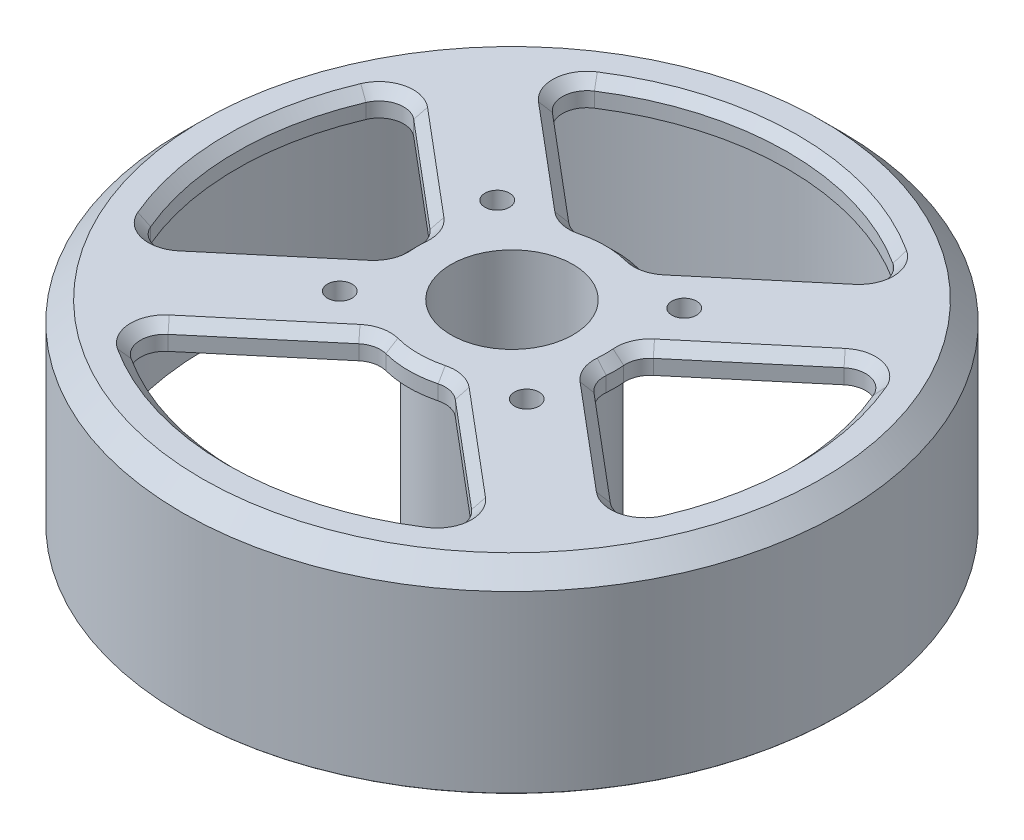
from build123d import *

# Parameters (mm, degrees)
HOLE_WIZARD_M3_1_D  = 2.5
CUT_EXTRUDE_1_DEPTH = 10
CHAMFER_1_SIZE      = 2
FILLET_1_R          = 2.5
CHAMFER_2_SIZE      = 1
CHAMFER_3_SIZE      = 0.05
CHAMFER_4_SIZE      = 0.05


with BuildPart() as part:
    # 草图6 → 旋转1 (revolve)
    with BuildSketch(Plane.XY, mode=Mode.PRIVATE) as revolve_1_sk:
        Polygon((33.5, 0), (33.5, 19.8), (6.2, 19.8), (6.2, -5.621788423), (4.95, -5.621788423), (4.95, -11.5), (6.2, -11.5), (6.2, -8.5), (9, -8.5), (9, -7.3), (8, -4), (8, 17.3), (31, 17.3), (31, 0), align=None)
    revolve(revolve_1_sk.sketch.rotate(Axis((0, 0, 0), (0, 1, 0)), 90), axis=Axis((0, 0, 0), (0, 1, 0)))

    # M3 螺纹孔1 (through all)
    with Locations(Plane(origin=(0, 19.8, 0), x_dir=(1, 0, 0), z_dir=(0, 1, 0))):
        with Locations((9.5, -8), (-9.5, -8), (-9.5, 8), (9.5, 8)):
            Hole(HOLE_WIZARD_M3_1_D / 2)

    # 草图11 → 切除-拉伸1 (cut)
    with BuildSketch(Plane(origin=(0, 19.8, 0), x_dir=(1, 0, 0), z_dir=(0, 1, 0))):
        with BuildLine():
            Line((17.852590074, 21.570466561), (3.841817237, 9.771921015))
            ThreePointArc((3.841817237, 9.771921015), (0, 10.5), (-3.841817237, 9.771921015))
            Line((-3.841817237, 9.771921015), (-17.852590074, 21.570466561))
            ThreePointArc((-17.852590074, 21.570466561), (0, 28), (17.852590074, 21.570466561))
        make_face()
        with BuildLine():
            Line((24.293947531, -13.92135458), (10.283174695, -2.122809033))
            ThreePointArc((10.283174695, -2.122809033), (10.5, 0), (10.283174695, 2.122809033))
            Line((10.283174695, 2.122809033), (24.293947531, 13.92135458))
            ThreePointArc((24.293947531, 13.92135458), (28, 0), (24.293947531, -13.92135458))
        make_face()
        with BuildLine():
            Line((17.852590074, -21.570466561), (3.841817237, -9.771921015))
            ThreePointArc((3.841817237, -9.771921015), (0, -10.5), (-3.841817237, -9.771921015))
            Line((-3.841817237, -9.771921015), (-17.852590074, -21.570466561))
            ThreePointArc((-17.852590074, -21.570466561), (0, -28), (17.852590074, -21.570466561))
        make_face()
        with BuildLine():
            Line((-10.283174695, 2.122809033), (-24.293947531, 13.92135458))
            ThreePointArc((-24.293947531, 13.92135458), (-28, 0), (-24.293947531, -13.92135458))
            Line((-24.293947531, -13.92135458), (-10.283174695, -2.122809033))
            ThreePointArc((-10.283174695, -2.122809033), (-10.5, 0), (-10.283174695, 2.122809033))
        make_face()
    extrude(amount=-CUT_EXTRUDE_1_DEPTH, mode=Mode.SUBTRACT)

    # 倒角1
    chamfer_1_edges = [part.edges().sort_by_distance(p)[0] for p in [
        (0, 19.8, 33.5),
    ]]
    chamfer(chamfer_1_edges, length=CHAMFER_1_SIZE)

    # 圆角1
    fillet_1_edges = [part.edges().sort_by_distance(p)[0] for p in [
        (17.852590074, 18.55, 21.570466561),
        (-17.852590074, 18.55, 21.570466561),
        (-3.841817237, 18.55, 9.771921015),
        (3.841817237, 18.55, 9.771921015),
        (24.293947531, 18.55, -13.92135458),
        (24.293947531, 18.55, 13.92135458),
        (10.283174695, 18.55, 2.122809033),
        (10.283174695, 18.55, -2.122809033),
        (-24.293947531, 18.55, 13.92135458),
        (-24.293947531, 18.55, -13.92135458),
        (-10.283174695, 18.55, -2.122809033),
        (-10.283174695, 18.55, 2.122809033),
        (-17.852590074, 18.55, -21.570466561),
        (17.852590074, 18.55, -21.570466561),
        (3.841817237, 18.55, -9.771921015),
        (-3.841817237, 18.55, -9.771921015),
    ]]
    fillet(fillet_1_edges, radius=FILLET_1_R)

    # 倒角2
    chamfer_2_edges = [part.edges().sort_by_distance(p)[0] for p in [
        (0, 19.8, 28),
        (-10.161632191, 19.8, 15.093870449),
        (0, 19.8, 10.5),
        (10.161632191, 19.8, 15.093870449),
        (28, 19.8, 0),
        (16.602989649, 19.8, 7.444758468),
        (10.5, 19.8, 0),
        (16.602989649, 19.8, -7.444758468),
        (0, 19.8, -28),
        (10.161632191, 19.8, -15.093870449),
        (-10.161632191, 19.8, -15.093870449),
        (0, 19.8, -10.5),
        (-16.602989649, 19.8, 7.444758468),
        (-28, 19.8, 0),
        (-10.5, 19.8, 0),
        (-16.602989649, 19.8, -7.444758468),
        (-16.306405676, 19.8, 21.595078628),
        (-3.841486524, 19.8, 10.13784984),
        (3.841486524, 19.8, 10.13784984),
        (16.306405676, 19.8, 21.595078628),
        (24.055073585, 19.8, 12.393535487),
        (10.643709543, 19.8, 2.060210005),
        (10.643709543, 19.8, -2.060210005),
        (24.055073585, 19.8, -12.393535487),
        (16.306405676, 19.8, -21.595078628),
        (-16.306405676, 19.8, -21.595078628),
        (-3.841486524, 19.8, -10.13784984),
        (3.841486524, 19.8, -10.13784984),
        (-24.055073585, 19.8, 12.393535487),
        (-10.643709543, 19.8, 2.060210005),
        (-10.643709543, 19.8, -2.060210005),
        (-24.055073585, 19.8, -12.393535487),
    ]]
    chamfer(chamfer_2_edges, length=CHAMFER_2_SIZE)

    # 倒角3
    chamfer_3_edges = [part.edges().sort_by_distance(p)[0] for p in [
        (0, 0, 33.5),
    ]]
    chamfer(chamfer_3_edges, length=CHAMFER_3_SIZE)

    # 倒角4
    chamfer_4_edges = [part.edges().sort_by_distance(p)[0] for p in [
        (0, -11.5, 6.2),
    ]]
    chamfer(chamfer_4_edges, length=CHAMFER_4_SIZE)


solid = part.part
